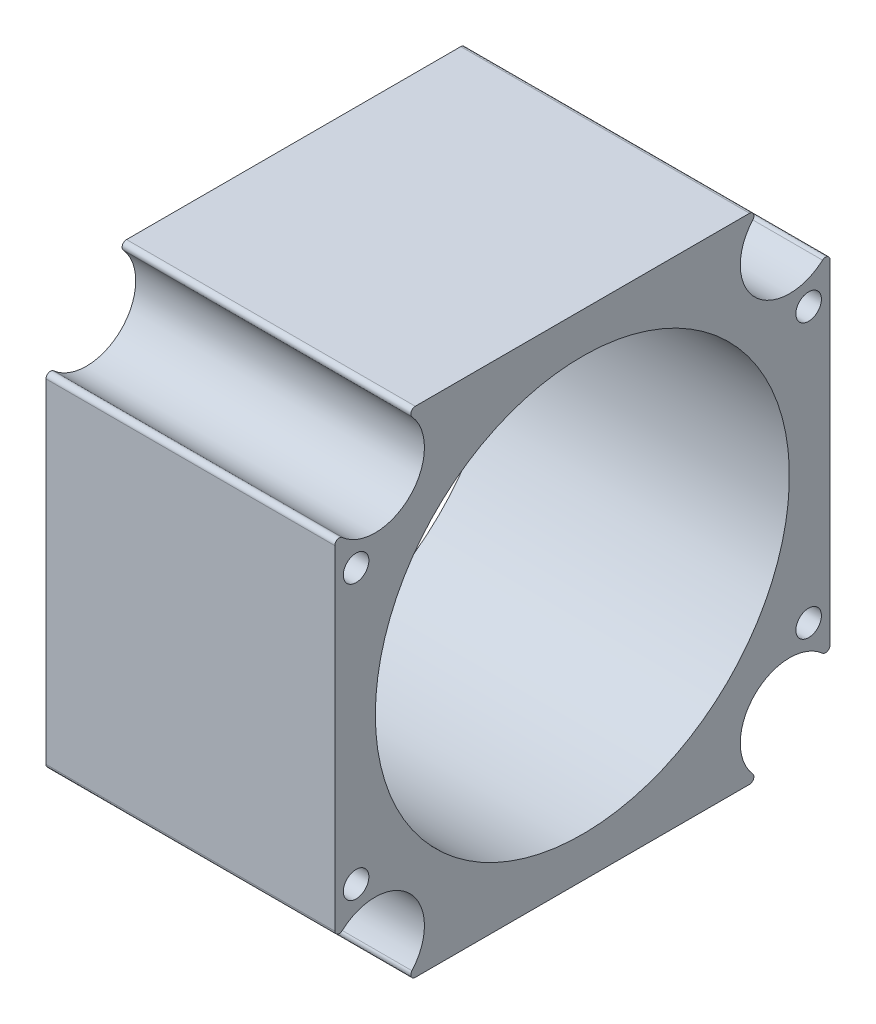
from build123d import *

# Parameters (mm, degrees)
BOSS_EXTRUDE1_DEPTH     = 32.766
SKETCH2_R               = 23.495
CUT_EXTRUDE1_DEPTH      = 52.487641673
M3_5X0_6_TAPPED_HOLE1_D = 2.9


with BuildPart() as part:
    # Sketch1 → Boss-Extrude1 (new body)
    with BuildSketch(Plane(origin=(0, 0, 0), x_dir=(0, 0, -1), z_dir=(1, 0, 0))):
        with BuildLine():
            Line((28.1, -18.939080971), (28.1, 18.939080971))
            ThreePointArc((28.1, 18.939080971), (27.799547486, 19.402749), (27.25359039, 19.317951577))
            ThreePointArc((27.25359039, 19.317951577), (19.564667335, 19.532372578), (19.341179036, 27.221037422))
            ThreePointArc((19.341179036, 27.221037422), (19.425455181, 27.766820849), (18.961909612, 28.067))
            Line((18.961909612, 28.067), (-18.961909612, 28.067))
            ThreePointArc((-18.961909612, 28.067), (-19.425455181, 27.766820849), (-19.341179036, 27.221037422))
            ThreePointArc((-19.341179036, 27.221037422), (-19.564667335, 19.532372578), (-27.25359039, 19.317951577))
            ThreePointArc((-27.25359039, 19.317951577), (-27.799547486, 19.402749), (-28.1, 18.939080971))
            Line((-28.1, 18.939080971), (-28.1, -18.939080971))
            ThreePointArc((-28.1, -18.939080971), (-27.799547486, -19.402749), (-27.25359039, -19.317951577))
            ThreePointArc((-27.25359039, -19.317951577), (-19.564667335, -19.532372578), (-19.341179036, -27.221037422))
            ThreePointArc((-19.341179036, -27.221037422), (-19.425455181, -27.766820849), (-18.961909612, -28.067))
            Line((-18.961909612, -28.067), (18.961909612, -28.067))
            ThreePointArc((18.961909612, -28.067), (19.425455181, -27.766820849), (19.341179036, -27.221037422))
            ThreePointArc((19.341179036, -27.221037422), (19.564667335, -19.532372578), (27.25359039, -19.317951577))
            ThreePointArc((27.25359039, -19.317951577), (27.799547486, -19.402749), (28.1, -18.939080971))
        make_face()
    extrude(amount=BOSS_EXTRUDE1_DEPTH)

    # Sketch2 → Cut-Extrude1 (cut, through all)
    with BuildSketch(Plane.ZY):
        Circle(SKETCH2_R)
    extrude(amount=-CUT_EXTRUDE1_DEPTH, mode=Mode.SUBTRACT)

    # M3.5x0.6 Tapped Hole1 (through all)
    with Locations(Plane(origin=(32.766, 0, 0), x_dir=(0, 0, -1), z_dir=(1, 0, 0))):
        with Locations((25.6794, 15.544299782), (25.6794, -15.544299782), (-25.6794, 15.544299782), (-25.6794, -15.544299782)):
            Hole(M3_5X0_6_TAPPED_HOLE1_D / 2)


solid = part.part
